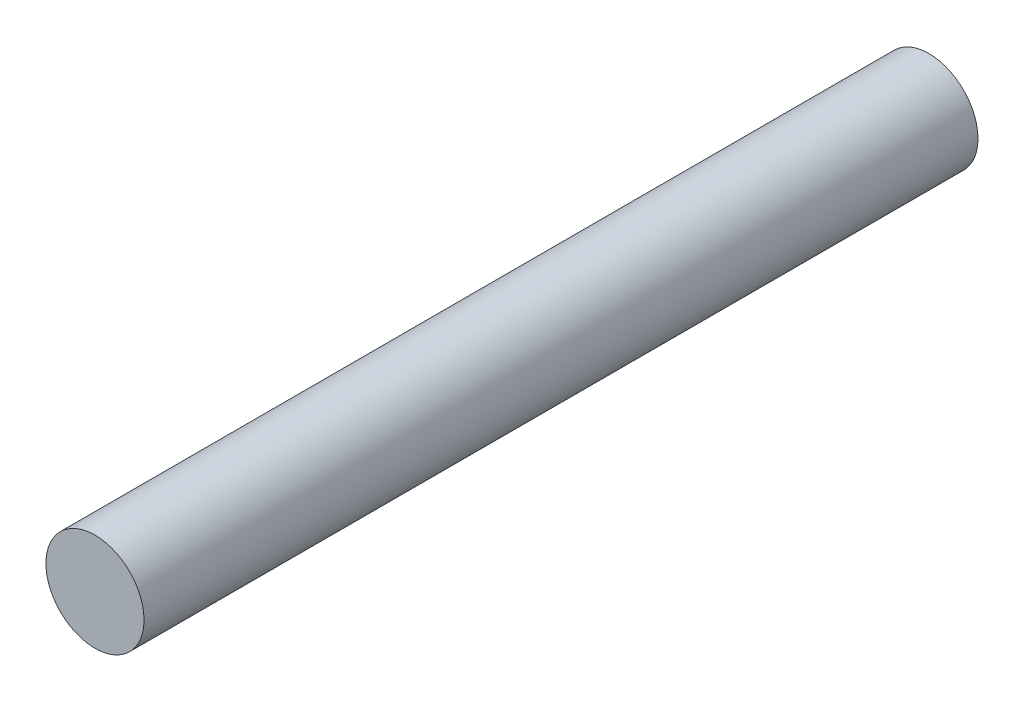
from build123d import *

# Parameters (mm, degrees)
ESQUISSE1_R      = 4
EXTRUSION1_DEPTH = 68


with BuildPart() as part:
    # Esquisse1 → Extrusion1 (new body)
    with BuildSketch(Plane.XY):
        Circle(ESQUISSE1_R)
    extrude(amount=-EXTRUSION1_DEPTH)


solid = part.part
